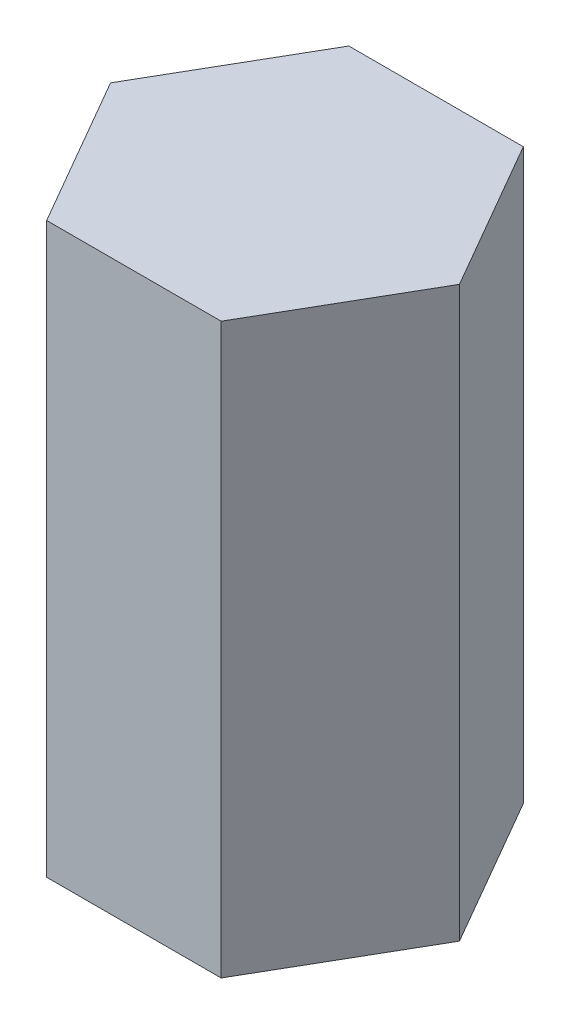
from build123d import *

# Parameters (mm, degrees)
SKETCH2_R           = 8.5
BOSS_EXTRUDE1_DEPTH = 32


with BuildPart() as part:
    # Sketch2 → Boss-Extrude1 (new body)
    with BuildSketch(Plane(origin=(0, 0, 0), x_dir=(1, 0, 0), z_dir=(0, 1, 0))):
        with BuildLine():
            Line((-4.907477288, 8.5), (-7.361215875, 4.250000098))
            ThreePointArc((-7.361215875, 4.250000098), (-4.249999964, 7.361215953), (-3e-08, 8.5))
            Line((-3e-08, 8.5), (-4.907477288, 8.5))
        make_face()
        with BuildLine():
            Line((-7.361215875, 4.250000098), (-9.814954576, 0))
            Line((-9.814954576, 0), (-7.361215915, -4.250000029))
            ThreePointArc((-7.361215915, -4.250000029), (-8.5, 4e-08), (-7.361215875, 4.250000098))
        make_face()
        with BuildLine():
            Line((4.907477288, 8.5), (-3e-08, 8.5))
            ThreePointArc((-3e-08, 8.5), (4.250000084, 7.361215884), (7.361216044, 4.249999806))
            Line((7.361216044, 4.249999806), (4.907477288, 8.5))
        make_face()
        Circle(SKETCH2_R)
        with BuildLine():
            ThreePointArc((8.5, 0), (8.210369486, -2.199962024), (7.361215786, -4.250000252))
            Line((7.361215786, -4.250000252), (9.814954576, 0))
            Line((9.814954576, 0), (7.361216044, 4.249999806))
            ThreePointArc((7.361216044, 4.249999806), (8.210369552, 2.199961775), (8.5, 0))
        make_face()
        with BuildLine():
            ThreePointArc((1.5e-08, -8.5), (-4.249999979, -7.361215944), (-7.361215915, -4.250000029))
            Line((-7.361215915, -4.250000029), (-4.907477288, -8.5))
            Line((-4.907477288, -8.5), (1.5e-08, -8.5))
        make_face()
        with BuildLine():
            ThreePointArc((7.361215786, -4.250000252), (4.24999988, -7.361216001), (1.5e-08, -8.5))
            Line((1.5e-08, -8.5), (4.907477288, -8.5))
            Line((4.907477288, -8.5), (7.361215786, -4.250000252))
        make_face()
    extrude(amount=BOSS_EXTRUDE1_DEPTH)


solid = part.part
